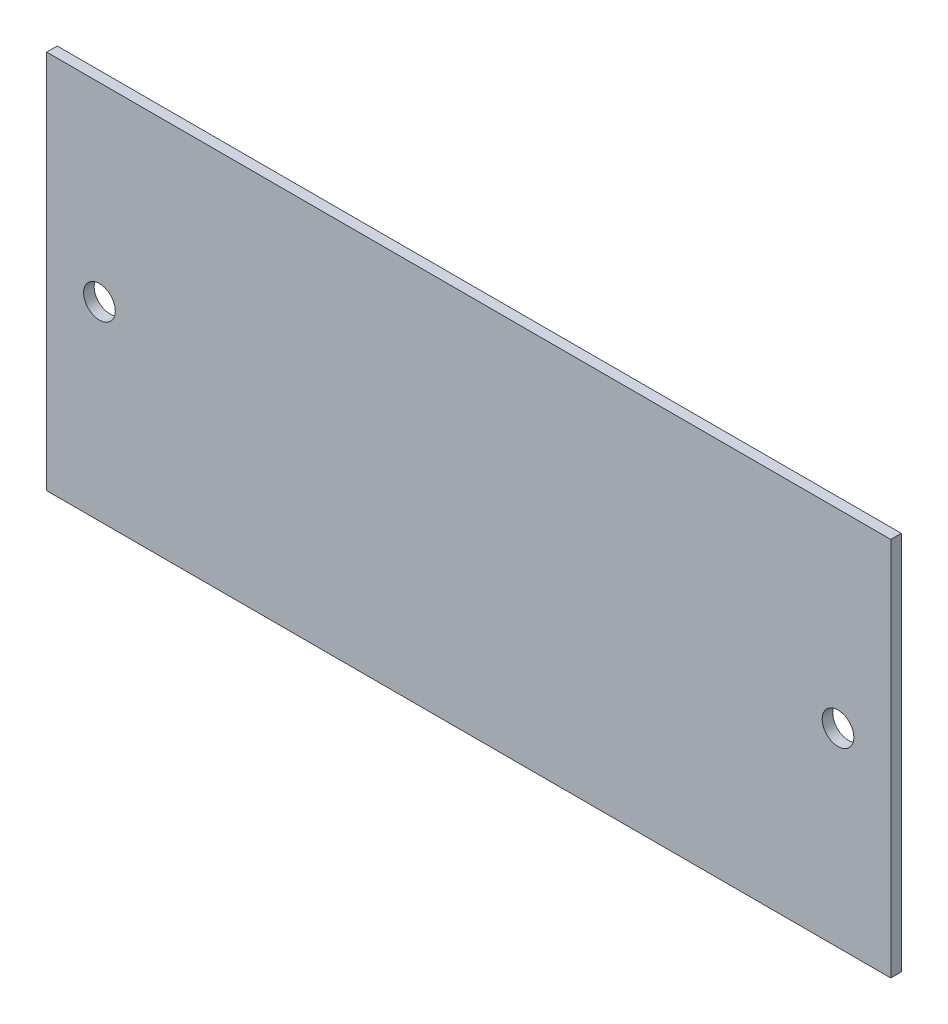
from build123d import *

# Parameters (mm, degrees)
SKETCH1_W          = 101.6
SKETCH1_H          = 45.72
BASE_EXTRUDE_DEPTH = 1.27
HOLE_CUT_REACH     = 113.42
SKETCH2_R          = 1.905


with BuildPart() as part:
    # Sketch1 → Base Extrude (new body)
    with BuildSketch(Plane.XY):
        with Locations((50.8, 22.86)):
            Rectangle(SKETCH1_W, SKETCH1_H)
    extrude(amount=BASE_EXTRUDE_DEPTH)

    # Sketch2 → Hole Cut (cut, up to next)
    with BuildSketch(Plane.XY.offset(1.27), mode=Mode.PRIVATE) as hole_cut_sk1:
        with Locations((6.35, 22.86)):
            Circle(SKETCH2_R)
    hole_cut_tool1 = extrude(hole_cut_sk1.sketch, amount=-HOLE_CUT_REACH, mode=Mode.PRIVATE) & part.part
    # Sketch2 → Hole Cut (cut, up to next)
    with BuildSketch(Plane.XY.offset(1.27), mode=Mode.PRIVATE) as hole_cut_sk2:
        with Locations(Location((95.25, 22.86, 0), (0, 0, 180))):
            Circle(SKETCH2_R)
    hole_cut_tool2 = extrude(hole_cut_sk2.sketch, amount=-HOLE_CUT_REACH, mode=Mode.PRIVATE) & part.part
    add(hole_cut_tool1.solids().sort_by_distance((6.35, 22.86, 1.27))[0], mode=Mode.SUBTRACT)
    add(hole_cut_tool2.solids().sort_by_distance((95.25, 22.86, 1.27))[0], mode=Mode.SUBTRACT)


solid = part.part
